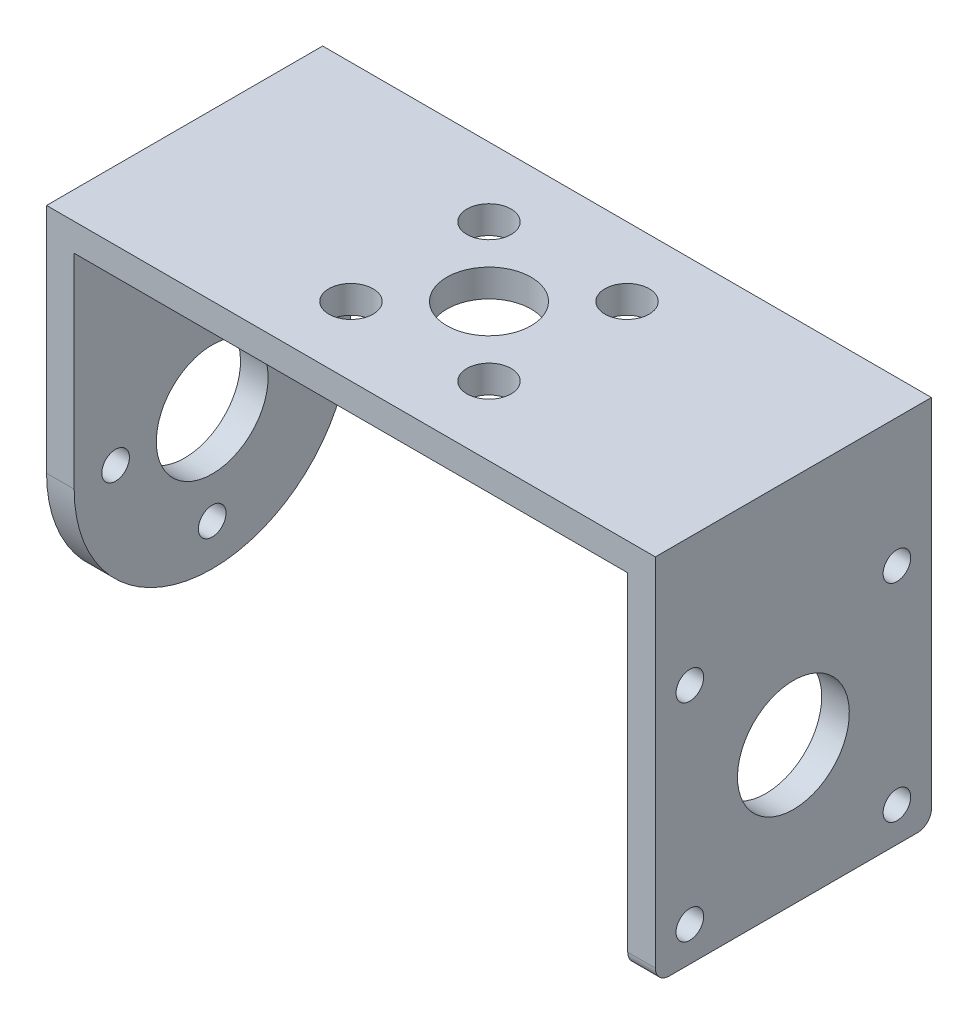
from build123d import *

# Parameters (mm, degrees)
BOSS_EXTRU_1_DEPTH                  = 10
ESQUISSE6_R                         = 3.05
ESQUISSE6_R_2                       = 1.6
ENL_V_MAT_EXTRU_4_DEPTH             = 37.117066603
ENL_V_MAT_EXTRU_1_REACH             = 54.565
ENL_V_MAT_EXTRU_1_DIRECTION_2_DEPTH = 53.56472201
ESQUISSE4_R                         = 4.05
ENL_V_MAT_EXTRU_2_DEPTH             = 53.56472201
ENL_V_MAT_EXTRU_3_REACH             = 54.565
ESQUISSE5_R                         = 1
ENL_V_MAT_EXTRU_5_REACH             = 54.565
ESQUISSE7_R                         = 1
CONG_1_R                            = 1


with BuildPart() as part:
    # Esquisse1 → Boss.-Extru.1 (new, symmetric)
    with BuildSketch(Plane.XY):
        Polygon((-22.05, 26.8), (22.05, 26.8), (22.05, 0), (20.05, 0), (20.05, 24.8), (-20.05, 24.8), (-20.05, 0), (-22.05, 0), align=None)
    extrude(amount=BOSS_EXTRU_1_DEPTH, both=True)

    # Esquisse6 → Enlèv. mat.-Extru.4 (cut, through all)
    with BuildSketch(Plane(origin=(0, 26.8, 0), x_dir=(1, 0, 0), z_dir=(0, 1, 0))):
        with Locations(Location((0, 0, 0), (0, 0, 270))):
            Circle(ESQUISSE6_R)
        with Locations(Location((-5, 5, 0), (0, 0, 270))):
            Circle(ESQUISSE6_R_2)
        with Locations(Location((5, 5, 0), (0, 0, 270))):
            Circle(ESQUISSE6_R_2)
        with Locations(Location((5, -5, 0), (0, 0, 270))):
            Circle(ESQUISSE6_R_2)
        with Locations(Location((-5, -5, 0), (0, 0, 270))):
            Circle(ESQUISSE6_R_2)
    extrude(amount=-ENL_V_MAT_EXTRU_4_DEPTH, mode=Mode.SUBTRACT)

    # Esquisse3 → Enlèv. mat.-Extru.1 (cut, up to next)
    with BuildSketch(Plane.ZY.offset(22.05), mode=Mode.PRIVATE) as enl_v_mat_extru_1_sk1:
        with BuildLine():
            ThreePointArc((0, 0), (-7.071067812, 2.928932188), (-10, 10))
            Line((-10, 10), (-10, 0))
            Line((-10, 0), (0, 0))
        make_face()
    enl_v_mat_extru_1_tool1 = extrude(enl_v_mat_extru_1_sk1.sketch, amount=-ENL_V_MAT_EXTRU_1_REACH, mode=Mode.PRIVATE) & part.part
    # Esquisse3 → Enlèv. mat.-Extru.1 (cut, up to next)
    with BuildSketch(Plane.ZY.offset(22.05), mode=Mode.PRIVATE) as enl_v_mat_extru_1_sk2:
        with BuildLine():
            ThreePointArc((10, 10), (7.071067812, 2.928932188), (0, 0))
            Line((0, 0), (10, 0))
            Line((10, 0), (10, 10))
        make_face()
    enl_v_mat_extru_1_tool2 = extrude(enl_v_mat_extru_1_sk2.sketch, amount=-ENL_V_MAT_EXTRU_1_REACH, mode=Mode.PRIVATE) & part.part
    add(enl_v_mat_extru_1_tool1.solids().sort_by_distance((-22.05, 2.233679, -7.766321))[0], mode=Mode.SUBTRACT)
    add(enl_v_mat_extru_1_tool2.solids().sort_by_distance((-22.05, 2.233679, 7.766321))[0], mode=Mode.SUBTRACT)

    # Esquisse3 → Enlèv. mat.-Extru.1 direction 2 (cut)
    with BuildSketch(Plane.ZY.offset(22.05)):
        with BuildLine():
            ThreePointArc((0, 0), (-7.071067812, 2.928932188), (-10, 10))
            Line((-10, 10), (-10, 0))
            Line((-10, 0), (0, 0))
        make_face()
        with BuildLine():
            ThreePointArc((10, 10), (7.071067812, 2.928932188), (0, 0))
            Line((0, 0), (10, 0))
            Line((10, 0), (10, 10))
        make_face()
    extrude(amount=ENL_V_MAT_EXTRU_1_DIRECTION_2_DEPTH, mode=Mode.SUBTRACT)

    # Esquisse4 → Enlèv. mat.-Extru.2 (cut, through all)
    with BuildSketch(Plane.ZY.offset(22.05)):
        with Locations(Location((0, 10, 0), (0, 0, 270))):
            Circle(ESQUISSE4_R)
    extrude(amount=-ENL_V_MAT_EXTRU_2_DEPTH, mode=Mode.SUBTRACT)

    # Esquisse5 → Enlèv. mat.-Extru.3 (cut, up to next)
    with BuildSketch(Plane.ZY.offset(22.05), mode=Mode.PRIVATE) as enl_v_mat_extru_3_sk1:
        with Locations(Location((-7, 10, 0), (0, 0, 270))):
            Circle(ESQUISSE5_R)
    enl_v_mat_extru_3_tool1 = extrude(enl_v_mat_extru_3_sk1.sketch, amount=-ENL_V_MAT_EXTRU_3_REACH, mode=Mode.PRIVATE) & part.part
    # Esquisse5 → Enlèv. mat.-Extru.3 (cut, up to next)
    with BuildSketch(Plane.ZY.offset(22.05), mode=Mode.PRIVATE) as enl_v_mat_extru_3_sk2:
        with Locations(Location((0, 17, 0), (0, 0, 270))):
            Circle(ESQUISSE5_R)
    enl_v_mat_extru_3_tool2 = extrude(enl_v_mat_extru_3_sk2.sketch, amount=-ENL_V_MAT_EXTRU_3_REACH, mode=Mode.PRIVATE) & part.part
    # Esquisse5 → Enlèv. mat.-Extru.3 (cut, up to next)
    with BuildSketch(Plane.ZY.offset(22.05), mode=Mode.PRIVATE) as enl_v_mat_extru_3_sk3:
        with Locations(Location((7, 10, 0), (0, 0, 270))):
            Circle(ESQUISSE5_R)
    enl_v_mat_extru_3_tool3 = extrude(enl_v_mat_extru_3_sk3.sketch, amount=-ENL_V_MAT_EXTRU_3_REACH, mode=Mode.PRIVATE) & part.part
    # Esquisse5 → Enlèv. mat.-Extru.3 (cut, up to next)
    with BuildSketch(Plane.ZY.offset(22.05), mode=Mode.PRIVATE) as enl_v_mat_extru_3_sk4:
        with Locations(Location((0, 3, 0), (0, 0, 270))):
            Circle(ESQUISSE5_R)
    enl_v_mat_extru_3_tool4 = extrude(enl_v_mat_extru_3_sk4.sketch, amount=-ENL_V_MAT_EXTRU_3_REACH, mode=Mode.PRIVATE) & part.part
    add(enl_v_mat_extru_3_tool1.solids().sort_by_distance((-22.05, 10, -7))[0], mode=Mode.SUBTRACT)
    add(enl_v_mat_extru_3_tool2.solids().sort_by_distance((-22.05, 17, 0))[0], mode=Mode.SUBTRACT)
    add(enl_v_mat_extru_3_tool3.solids().sort_by_distance((-22.05, 10, 7))[0], mode=Mode.SUBTRACT)
    add(enl_v_mat_extru_3_tool4.solids().sort_by_distance((-22.05, 3, 0))[0], mode=Mode.SUBTRACT)

    # Esquisse7 → Enlèv. mat.-Extru.5 (cut, up to next)
    with BuildSketch(Plane(origin=(22.05, 0, 0), x_dir=(0, 0, -1), z_dir=(1, 0, 0)), mode=Mode.PRIVATE) as enl_v_mat_extru_5_sk1:
        with Locations(Location((-7.5, 2.5, 0), (0, 0, 90))):
            Circle(ESQUISSE7_R)
    enl_v_mat_extru_5_tool1 = extrude(enl_v_mat_extru_5_sk1.sketch, amount=-ENL_V_MAT_EXTRU_5_REACH, mode=Mode.PRIVATE) & part.part
    # Esquisse7 → Enlèv. mat.-Extru.5 (cut, up to next)
    with BuildSketch(Plane(origin=(22.05, 0, 0), x_dir=(0, 0, -1), z_dir=(1, 0, 0)), mode=Mode.PRIVATE) as enl_v_mat_extru_5_sk2:
        with Locations(Location((7.5, 2.5, 0), (0, 0, 90))):
            Circle(ESQUISSE7_R)
    enl_v_mat_extru_5_tool2 = extrude(enl_v_mat_extru_5_sk2.sketch, amount=-ENL_V_MAT_EXTRU_5_REACH, mode=Mode.PRIVATE) & part.part
    # Esquisse7 → Enlèv. mat.-Extru.5 (cut, up to next)
    with BuildSketch(Plane(origin=(22.05, 0, 0), x_dir=(0, 0, -1), z_dir=(1, 0, 0)), mode=Mode.PRIVATE) as enl_v_mat_extru_5_sk3:
        with Locations(Location((7.5, 17.5, 0), (0, 0, 90))):
            Circle(ESQUISSE7_R)
    enl_v_mat_extru_5_tool3 = extrude(enl_v_mat_extru_5_sk3.sketch, amount=-ENL_V_MAT_EXTRU_5_REACH, mode=Mode.PRIVATE) & part.part
    # Esquisse7 → Enlèv. mat.-Extru.5 (cut, up to next)
    with BuildSketch(Plane(origin=(22.05, 0, 0), x_dir=(0, 0, -1), z_dir=(1, 0, 0)), mode=Mode.PRIVATE) as enl_v_mat_extru_5_sk4:
        with Locations(Location((-7.5, 17.5, 0), (0, 0, 90))):
            Circle(ESQUISSE7_R)
    enl_v_mat_extru_5_tool4 = extrude(enl_v_mat_extru_5_sk4.sketch, amount=-ENL_V_MAT_EXTRU_5_REACH, mode=Mode.PRIVATE) & part.part
    add(enl_v_mat_extru_5_tool1.solids().sort_by_distance((22.05, 2.5, 7.5))[0], mode=Mode.SUBTRACT)
    add(enl_v_mat_extru_5_tool2.solids().sort_by_distance((22.05, 2.5, -7.5))[0], mode=Mode.SUBTRACT)
    add(enl_v_mat_extru_5_tool3.solids().sort_by_distance((22.05, 17.5, -7.5))[0], mode=Mode.SUBTRACT)
    add(enl_v_mat_extru_5_tool4.solids().sort_by_distance((22.05, 17.5, 7.5))[0], mode=Mode.SUBTRACT)

    # Congé1
    cong_1_edges = [part.edges().sort_by_distance(p)[0] for p in [
        (21.05, 0, 10),
        (21.05, 0, -10),
    ]]
    fillet(cong_1_edges, radius=CONG_1_R)


solid = part.part
